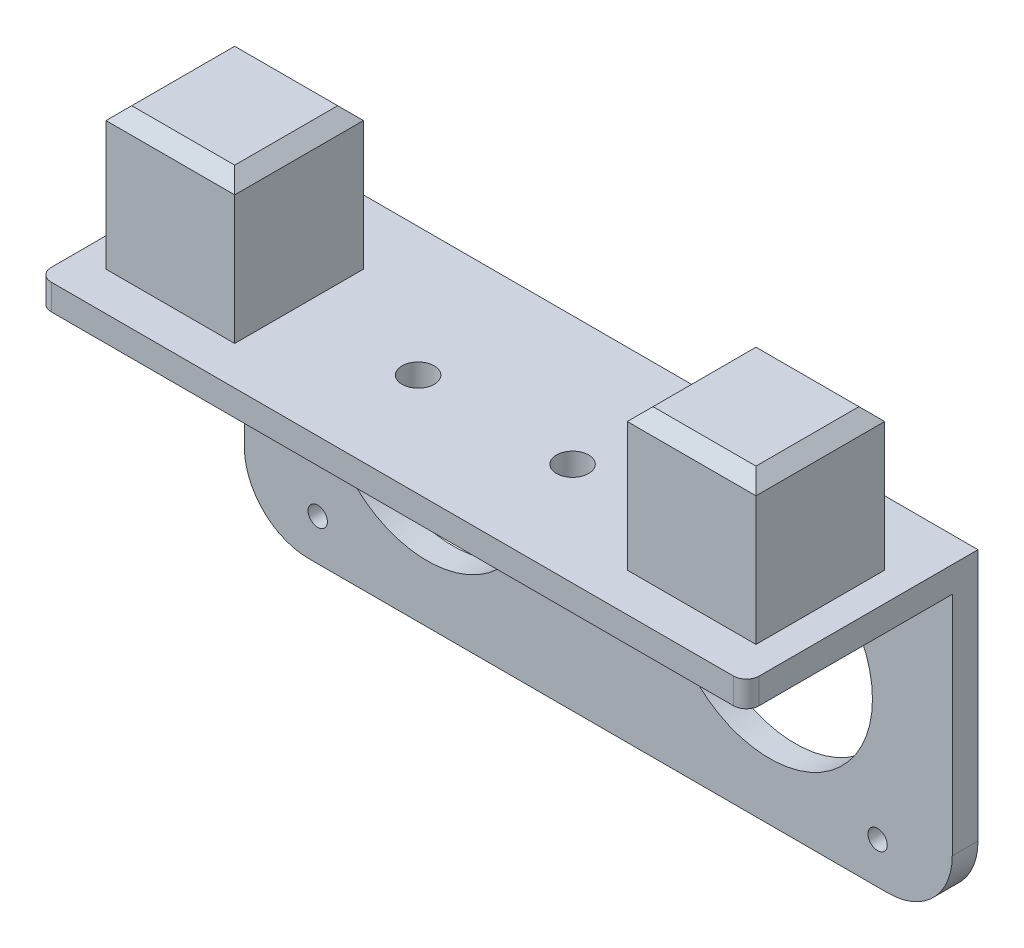
from build123d import *

# Parameters (mm, degrees)
SKETCH1_W             = 55
SKETCH1_H             = 22.6
BOSS_EXTRUDE1_DEPTH   = 2
SKETCH2_R             = 8
CUT_EXTRUDE2_DEPTH    = 2
SKETCH2_4_R           = 8
CUT_EXTRUDE3_DEPTH    = 2
SKETCH5_W             = 10
SKETCH5_H             = 4.6
CUT_EXTRUDE4_DEPTH    = 2
SKETCH6_W             = 55
SKETCH6_H             = 2
BOSS_EXTRUDE2_DEPTH   = 18
SKETCH9_W             = 10
SKETCH9_H             = 10
BOSS_EXTRUDE4_DEPTH   = 13
M3X0_5_TAPPED_HOLE1_D = 2.5
M3X0_5_TAPPED_HOLE2_D = 2.5
FILLET1_R             = 5
FILLET2_R             = 5
FILLET4_R             = 1.8
FILLET5_R             = 1.8
CHAMFER2_SIZE         = 1
FILLET10_R            = 1
SKETCH25_R            = 0.75
CUT_EXTRUDE5_DEPTH    = 10


with BuildPart() as part:
    # Sketch1 → Boss-Extrude1 (new body)
    with BuildSketch(Plane.XY):
        with Locations((-1.071942446, 12.368165468)):
            Rectangle(SKETCH1_W, SKETCH1_H)
    extrude(amount=BOSS_EXTRUDE1_DEPTH)

    # Sketch2 → Cut-Extrude2 (cut)
    with BuildSketch(Plane.XY.offset(2)):
        with Locations((-14.371942446, 13.518165468)):
            Circle(SKETCH2_R)
    extrude(amount=-CUT_EXTRUDE2_DEPTH, mode=Mode.SUBTRACT)

    # Sketch2<4> → Cut-Extrude3 (cut)
    with BuildSketch(Plane.XY.offset(2)):
        with Locations((-14.371942446, 13.518165468)):
            Circle(SKETCH2_4_R)
        with Locations((12.228057554, 13.518165468)):
            Circle(SKETCH2_4_R)
    extrude(amount=-CUT_EXTRUDE3_DEPTH, mode=Mode.SUBTRACT)

    # Sketch5 → Cut-Extrude4 (cut)
    with BuildSketch(Plane.XY.offset(2)):
        with Locations((-1.171942446, 21.368165468)):
            Rectangle(SKETCH5_W, SKETCH5_H)
    extrude(amount=-CUT_EXTRUDE4_DEPTH, mode=Mode.SUBTRACT)

    # Sketch6 → Boss-Extrude2 (add)
    with BuildSketch(Plane(origin=(0, 0, 0), x_dir=(-1, 0, 0), z_dir=(0, 0, -1))):
        with Locations((1.071942446, 24.668165468)):
            Rectangle(SKETCH6_W, SKETCH6_H)
    extrude(amount=-BOSS_EXTRUDE2_DEPTH)

    # Sketch9 → Boss-Extrude4 (add)
    with BuildSketch(Plane(origin=(0, 23.668165468, 0), x_dir=(-1, 0, 0), z_dir=(0, -1, 0))):
        with Locations((21.321942446, -10)):
            Rectangle(SKETCH9_W, SKETCH9_H)
        with Locations((-19.178057554, -10)):
            Rectangle(SKETCH9_W, SKETCH9_H)
    extrude(amount=-BOSS_EXTRUDE4_DEPTH)

    # M3x0.5 Tapped Hole1 (through all)
    with Locations(Plane(origin=(0, 23.668165468, 0), x_dir=(-1, 0, 0), z_dir=(0, -1, 0))):
        with Locations((-4.928057554, -10)):
            Hole(M3X0_5_TAPPED_HOLE1_D / 2)

    # M3x0.5 Tapped Hole2 (through all)
    with Locations(Plane(origin=(0, 23.668165468, 0), x_dir=(-1, 0, 0), z_dir=(0, -1, 0))):
        with Locations((7.071942446, -10)):
            Hole(M3X0_5_TAPPED_HOLE2_D / 2)

    # Fillet1
    fillet1_edges = [part.edges().sort_by_distance(p)[0] for p in [
        (-28.571942446, 1.068165468, 1),
    ]]
    fillet(fillet1_edges, radius=FILLET1_R)

    # Fillet2
    fillet2_edges = [part.edges().sort_by_distance(p)[0] for p in [
        (26.428057554, 1.068165468, 1),
    ]]
    fillet(fillet2_edges, radius=FILLET2_R)

    # Fillet4
    fillet4_edges = [part.edges().sort_by_distance(p)[0] for p in [
        (3.828057554, 19.068165468, 1),
    ]]
    fillet(fillet4_edges, radius=FILLET4_R)

    # Fillet5
    fillet5_edges = [part.edges().sort_by_distance(p)[0] for p in [
        (-6.171942446, 19.068165468, 1),
    ]]
    fillet(fillet5_edges, radius=FILLET5_R)

    # Chamfer2
    chamfer2_edges = [part.edges().sort_by_distance(p)[0] for p in [
        (19.178057554, 36.668165468, 15),
        (14.178057554, 36.668165468, 10),
        (19.178057554, 36.668165468, 5),
        (24.178057554, 36.668165468, 10),
        (-21.321942446, 36.668165468, 15),
        (-26.321942446, 36.668165468, 10),
        (-21.321942446, 36.668165468, 5),
        (-16.321942446, 36.668165468, 10),
    ]]
    chamfer(chamfer2_edges, length=CHAMFER2_SIZE)

    # Fillet10
    fillet10_edges = [part.edges().sort_by_distance(p)[0] for p in [
        (26.428057554, 24.668165468, 18),
        (-28.571942446, 24.668165468, 18),
    ]]
    fillet(fillet10_edges, radius=FILLET10_R)

    # Sketch25 → Cut-Extrude5 (cut)
    with BuildSketch(Plane.XY.offset(2)):
        with Locations((20.628057554, 4.268165468)):
            Circle(SKETCH25_R)
        with Locations((20.628057554, 22.768165468)):
            Circle(SKETCH25_R)
        with Locations((-22.871942446, 4.268165468)):
            Circle(SKETCH25_R)
        with Locations((-22.871942446, 22.768165468)):
            Circle(SKETCH25_R)
    extrude(amount=-CUT_EXTRUDE5_DEPTH, mode=Mode.SUBTRACT)


solid = part.part
